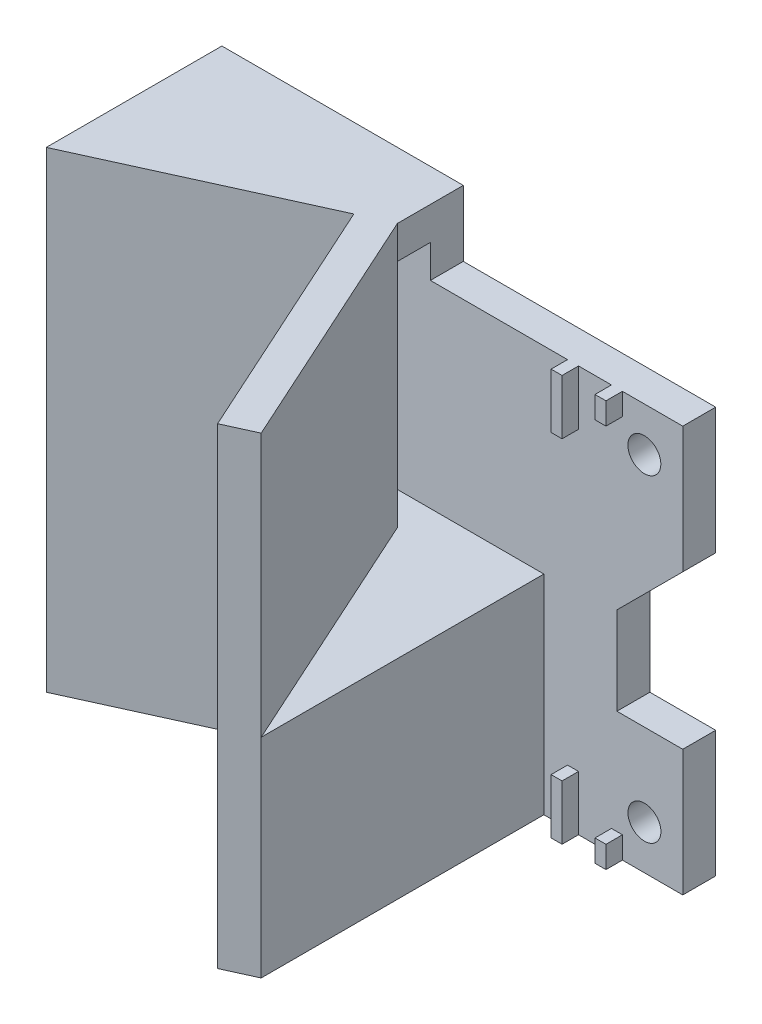
from build123d import *

# Parameters (mm, degrees)
CROQUIS1_R              = 1.5
SALIENTE_EXTRUIR1_DEPTH = 3
CROQUIS3_W              = 22
CROQUIS3_H              = 37
SALIENTE_EXTRUIR2_DEPTH = 13
CORTAR_EXTRUIR1_START   = -37
CORTAR_EXTRUIR1_DEPTH   = 37
SALIENTE_EXTRUIR4_DEPTH = 6
CROQUIS7_W              = 3.002058729
CROQUIS7_H              = 21
CORTAR_EXTRUIR2_DEPTH   = 22
CROQUIS8_W              = 3
CROQUIS8_H              = 43
SALIENTE_EXTRUIR5_DEPTH = 25
SALIENTE_EXTRUIR6_START = -19
SALIENTE_EXTRUIR6_DEPTH = 19
CROQUIS13_W             = 1
CROQUIS13_H             = 2
CROQUIS13_H_2           = 5
SALIENTE_EXTRUIR8_DEPTH = 1.5


with BuildPart() as part:
    # Croquis1 → Saliente-Extruir1 (new body)
    with BuildSketch(Plane.XY):
        with BuildLine():
            Line((-56.197309417, 29.461883408), (-56.197309417, 24.961883408))
            Line((-56.197309417, 24.961883408), (-49.197309417, 17.961883408))
            Line((-49.197309417, 17.961883408), (-49.197309417, 4.961883408))
            Line((-49.197309417, 4.961883408), (-56.197309417, 4.961883408))
            Line((-56.197309417, 4.961883408), (-56.197309417, 0.461883408))
            ThreePointArc((-56.197309417, 0.461883408), (-55.099110766, -2.293519818), (-52.406664651, -3.538116592))
            Line((-52.406664651, -3.538116592), (-4.197309417, -3.538116592))
            Line((-4.197309417, -3.538116592), (-4.197309417, 7.961883408))
            Line((-4.197309417, 7.961883408), (-10.197309417, 7.961883408))
            Line((-10.197309417, 7.961883408), (-10.197309417, 15.961883408))
            Line((-10.197309417, 15.961883408), (-4.197309417, 21.961883408))
            Line((-4.197309417, 21.961883408), (-4.197309417, 33.461883408))
            Line((-4.197309417, 33.461883408), (-52.197309417, 33.461883408))
            ThreePointArc((-52.197309417, 33.461883408), (-55.025736542, 32.290310533), (-56.197309417, 29.461883408))
        make_face()
        with Locations((-52.19152813, 0.461883408)):
            Circle(CROQUIS1_R, mode=Mode.SUBTRACT)
        with Locations((-7.69152813, 0.461883408)):
            Circle(CROQUIS1_R, mode=Mode.SUBTRACT)
        with Locations((-52.197309417, 29.461883408)):
            Circle(CROQUIS1_R, mode=Mode.SUBTRACT)
        with Locations((-7.697309417, 29.461882832)):
            Circle(CROQUIS1_R, mode=Mode.SUBTRACT)
    extrude(amount=SALIENTE_EXTRUIR1_DEPTH)

    # Croquis3 → Saliente-Extruir2 (add)
    with BuildSketch(Plane.XY.offset(3)):
        with Locations((-38.197309417, 14.961883408)):
            Rectangle(CROQUIS3_W, CROQUIS3_H)
    extrude(amount=SALIENTE_EXTRUIR2_DEPTH)

    # Croquis4 → Cortar-Extruir1 (cut)
    with BuildSketch(Plane.XZ.offset(3.538116592).offset(CORTAR_EXTRUIR1_START)):
        Polygon((-27.197309417, 16), (-27.197309417, 6.002058729), (-49.197309417, 16), align=None)
    extrude(amount=CORTAR_EXTRUIR1_DEPTH, mode=Mode.SUBTRACT)

    # Croquis6 → Saliente-Extruir4 (add)
    with BuildSketch(Plane(origin=(0, 33.461883408, 0), x_dir=(1, 0, 0), z_dir=(0, 1, 0))):
        Polygon((-27.197309417, -6.002058729), (-49.197309417, -16), (-49.197309417, 0), (-27.197309417, 0), align=None)
    extrude(amount=SALIENTE_EXTRUIR4_DEPTH)

    # Croquis7 → Cortar-Extruir2 (cut)
    with BuildSketch(Plane(origin=(-27.197309417, 0, 0), x_dir=(0, 0, -1), z_dir=(1, 0, 0))):
        with Locations((-4.501029365, 25.961883408)):
            Rectangle(CROQUIS7_W, CROQUIS7_H)
    extrude(amount=-CORTAR_EXTRUIR2_DEPTH, mode=Mode.SUBTRACT)

    # Croquis8 → Saliente-Extruir5 (add)
    with BuildSketch(Plane(origin=(-2.394740987, 0, -5.269515022), x_dir=(0.9103985682863143, 0, -0.4137323372208525), z_dir=(0.4137323372208525, 0, 0.9103985682863143))):
        with Locations((-28.743637341, 17.961883408)):
            Rectangle(CROQUIS8_W, CROQUIS8_H)
    extrude(amount=SALIENTE_EXTRUIR5_DEPTH)

    # Croquis9 → Saliente-Extruir6 (add)
    with BuildSketch(Plane.XZ.offset(3.538116592).offset(SALIENTE_EXTRUIR6_START)):
        Polygon((-16.854000987, 28.762022936), (-27.197309417, 6.002058729), (-27.197309417, 3), (-16.854000987, 3), align=None)
    extrude(amount=SALIENTE_EXTRUIR6_DEPTH)

    # Croquis13 → Saliente-Extruir8 (add)
    with BuildSketch(Plane.XY.offset(3)):
        with Locations((-10.197309417, -2.538116592)):
            Rectangle(CROQUIS13_W, CROQUIS13_H)
        with Locations((-10.197309417, 32.461883408)):
            Rectangle(CROQUIS13_W, CROQUIS13_H)
        with Locations((-14.197309417, 30.961883408)):
            Rectangle(CROQUIS13_W, CROQUIS13_H_2)
        with Locations((-14.197309417, -1.038116592)):
            Rectangle(CROQUIS13_W, CROQUIS13_H_2)
    extrude(amount=SALIENTE_EXTRUIR8_DEPTH)


solid = part.part
